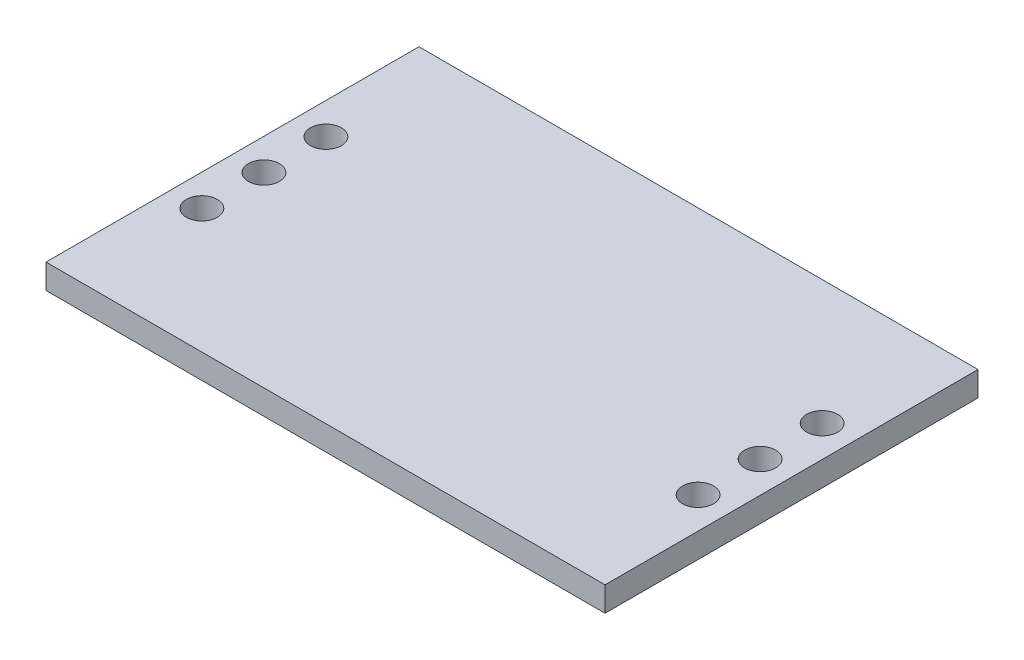
from build123d import *

# Parameters (mm, degrees)
SKETCH2_W           = 72.1
SKETCH2_H           = 48.1
BOSS_EXTRUDE1_DEPTH = 3.175
SKETCH3_R           = 2
CUT_EXTRUDE1_DEPTH  = 3.175


with BuildPart() as part:
    # Sketch2 → Boss-Extrude1 (new body)
    with BuildSketch(Plane(origin=(0, 0, 0), x_dir=(1, 0, 0), z_dir=(0, 1, 0))):
        with Locations((-13.435291078, -4.09940834)):
            Rectangle(SKETCH2_W, SKETCH2_H)
    extrude(amount=BOSS_EXTRUDE1_DEPTH)

    # Sketch3 → Cut-Extrude1 (cut)
    with BuildSketch(Plane(origin=(0, 3.175, 0), x_dir=(1, 0, 0), z_dir=(0, 1, 0))):
        with Locations(Location((18.564708922, -4.09940834, 0), (0, 0, 270))):
            Circle(SKETCH3_R)
        with Locations(Location((18.564708922, 3.90059166, 0), (0, 0, 270))):
            Circle(SKETCH3_R)
        with Locations(Location((18.564708922, -12.09940834, 0), (0, 0, 90))):
            Circle(SKETCH3_R)
        with Locations(Location((-45.435291078, -12.09940834, 0), (0, 0, 270))):
            Circle(SKETCH3_R)
        with Locations(Location((-45.435291078, -4.09940834, 0), (0, 0, 90))):
            Circle(SKETCH3_R)
        with Locations(Location((-45.435291078, 3.90059166, 0), (0, 0, 90))):
            Circle(SKETCH3_R)
    extrude(amount=-CUT_EXTRUDE1_DEPTH, mode=Mode.SUBTRACT)


solid = part.part
